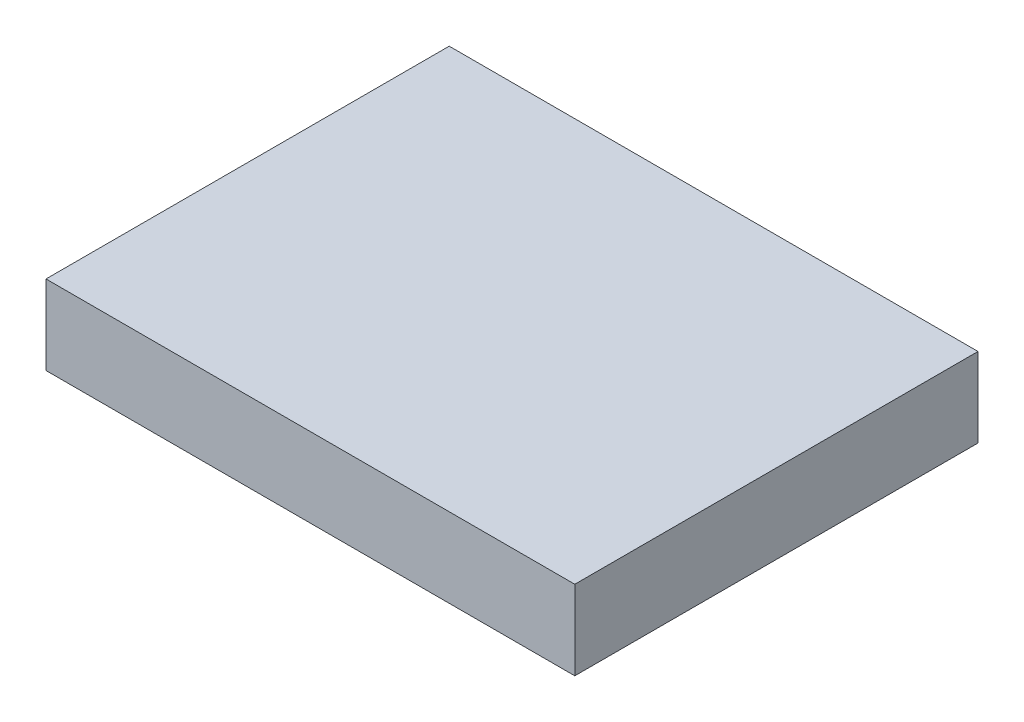
from build123d import *

# Parameters (mm, degrees)
SKETCH2_W           = 80
SKETCH2_H           = 61
BOSS_EXTRUDE1_DEPTH = 12


with BuildPart() as part:
    # Sketch2 → Boss-Extrude1 (new body)
    with BuildSketch(Plane(origin=(0, 0, 0), x_dir=(1, 0, 0), z_dir=(0, 1, 0))):
        Rectangle(SKETCH2_W, SKETCH2_H)
    extrude(amount=BOSS_EXTRUDE1_DEPTH)


solid = part.part
